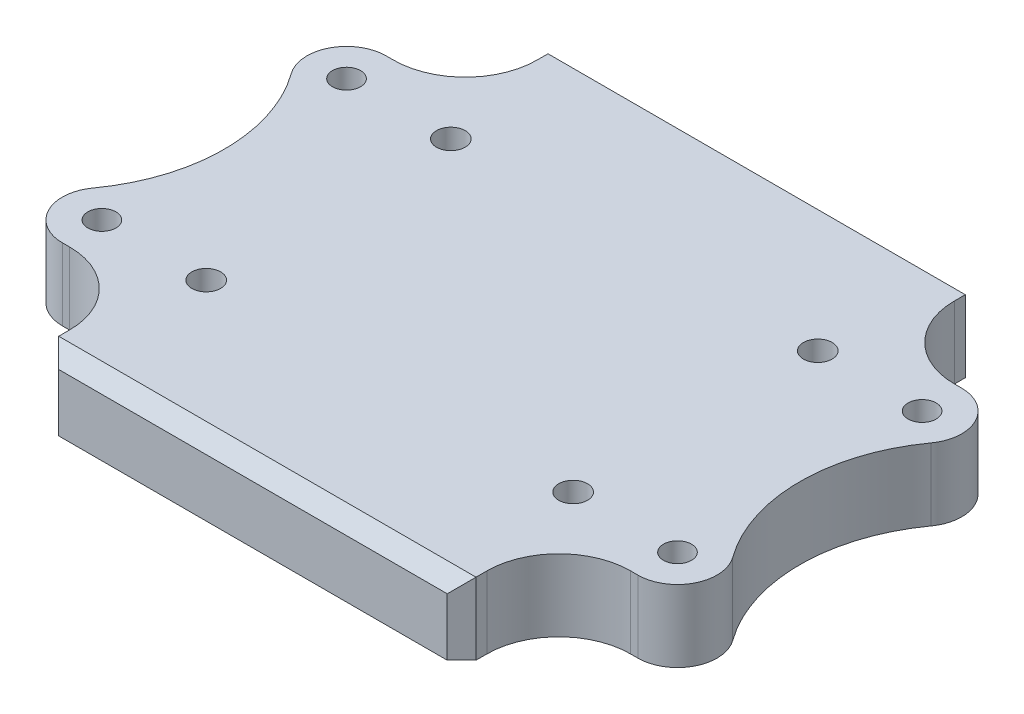
from build123d import *

# Parameters (mm, degrees)
BOSS_EXTRUDE1_DEPTH        = 10
SKETCH2_W                  = 58
SKETCH2_H                  = 10
BOSS_EXTRUDE2_DEPTH        = 13.5
SKETCH3_W                  = 58
SKETCH3_H                  = 10
BOSS_EXTRUDE3_DEPTH        = 13.5
F_4_0_4_DIAMETER_HOLE1_D   = 4
F_3_9_3_9_DIAMETER_HOLE1_D = 3.9
CHAMFER1_SIZE              = 1.5
CHAMFER2_SIZE              = 2
FILLET1_R                  = 10


with BuildPart() as part:
    # Sketch1 → Boss-Extrude1 (new body)
    with BuildSketch(Plane.XZ.offset(10)):
        with BuildLine():
            Line((-40, -22.5), (40, -22.5))
            ThreePointArc((40, -22.5), (44.897390752, -19.503110829), (44.457713391, -13.778386844))
            ThreePointArc((44.457713391, -13.778386844), (40, 0), (44.457713391, 13.778386844))
            ThreePointArc((44.457713391, 13.778386844), (44.897390752, 19.503110829), (40, 22.5))
            Line((40, 22.5), (-40, 22.5))
            ThreePointArc((-40, 22.5), (-44.897390752, 19.503110829), (-44.457713391, 13.778386844))
            ThreePointArc((-44.457713391, 13.778386844), (-40, 0), (-44.457713391, -13.778386844))
            ThreePointArc((-44.457713391, -13.778386844), (-44.897390752, -19.503110829), (-40, -22.5))
        make_face()
    extrude(amount=-BOSS_EXTRUDE1_DEPTH)

    # Sketch2 → Boss-Extrude2 (add)
    with BuildSketch(Plane(origin=(0, 0, -22.5), x_dir=(-1, 0, 0), z_dir=(0, 0, -1))):
        with Locations((0, -5)):
            Rectangle(SKETCH2_W, SKETCH2_H)
    extrude(amount=BOSS_EXTRUDE2_DEPTH)

    # Sketch3 → Boss-Extrude3 (add)
    with BuildSketch(Plane.XY.offset(22.5)):
        with Locations((0, -5)):
            Rectangle(SKETCH3_W, SKETCH3_H)
    extrude(amount=BOSS_EXTRUDE3_DEPTH)

    # Ø4.0 (4) Diameter Hole1 (through all)
    with Locations(Plane(origin=(0, 0, 0), x_dir=(1, 0, 0), z_dir=(0, 1, 0))):
        with Locations((-25.5, -17), (-25.5, 17), (25.5, 17), (25.5, -17)):
            Hole(F_4_0_4_DIAMETER_HOLE1_D / 2)

    # Ø3.9 (3.9) Diameter Hole1 (through all)
    with Locations(Plane(origin=(0, -10, 0), x_dir=(-1, 0, 0), z_dir=(0, -1, 0))):
        with Locations((40, 17), (-40, 17), (-40, -17), (40, -17)):
            Hole(F_3_9_3_9_DIAMETER_HOLE1_D / 2)

    # Chamfer1
    chamfer1_edges = [part.edges().sort_by_distance(p)[0] for p in [
        (-41.95, -10, 17),
        (38.05, -10, 17),
        (38.05, -10, -17),
        (-41.95, -10, -17),
    ]]
    chamfer(chamfer1_edges, length=CHAMFER1_SIZE)

    # Chamfer2
    chamfer2_edges = [part.edges().sort_by_distance(p)[0] for p in [
        (-29, -5, -36),
        (0, 0, -36),
        (29, -5, -36),
        (29, -5, 36),
        (0, 0, 36),
        (-29, -5, 36),
    ]]
    chamfer(chamfer2_edges, length=CHAMFER2_SIZE)

    # Fillet1
    fillet1_edges = [part.edges().sort_by_distance(p)[0] for p in [
        (-29, -5, -22.5),
        (29, -5, -22.5),
        (29, -5, 22.5),
        (-29, -5, 22.5),
    ]]
    fillet(fillet1_edges, radius=FILLET1_R)


solid = part.part
